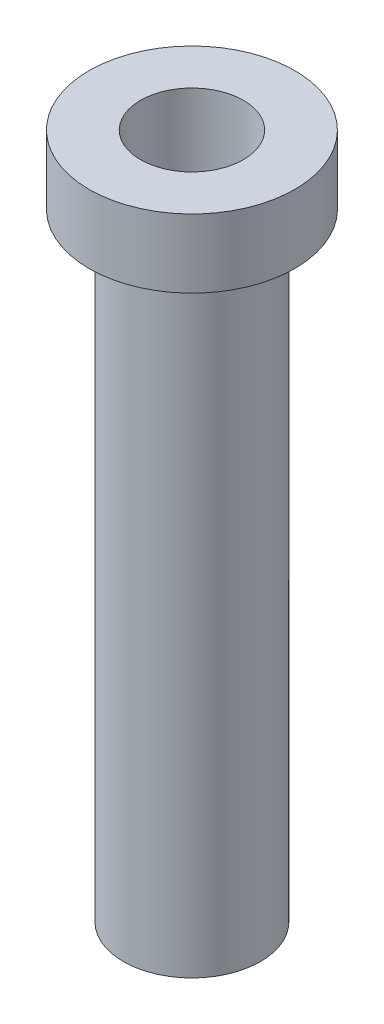
from build123d import *

# Parameters (mm, degrees)
SKETCH1_R           = 10
SKETCH1_R_2         = 7.5
BOSS_EXTRUDE1_DEPTH = 100
BOSS_EXTRUDE2_START = -10
SKETCH2_R           = 15
SKETCH2_R_2         = 10
BOSS_EXTRUDE2_DEPTH = 10


with BuildPart() as part:
    # Sketch1 → Boss-Extrude1 (new body)
    with BuildSketch(Plane(origin=(0, 0, 0), x_dir=(1, 0, 0), z_dir=(0, 1, 0))):
        with Locations(Location((0, 0, 0), (0, 0, 90))):
            Circle(SKETCH1_R)
        with Locations(Location((0, 0, 0), (0, 0, 90))):
            Circle(SKETCH1_R_2, mode=Mode.SUBTRACT)
    extrude(amount=BOSS_EXTRUDE1_DEPTH)

    # Sketch2 → Boss-Extrude2 (add)
    with BuildSketch(Plane(origin=(0, 100, 0), x_dir=(1, 0, 0), z_dir=(0, 1, 0)).offset(BOSS_EXTRUDE2_START)):
        with Locations(Location((0, 0, 0), (0, 0, 270))):
            Circle(SKETCH2_R)
        with Locations(Location((0, 0, 0), (0, 0, 90))):
            Circle(SKETCH2_R_2, mode=Mode.SUBTRACT)
    extrude(amount=BOSS_EXTRUDE2_DEPTH)


solid = part.part
